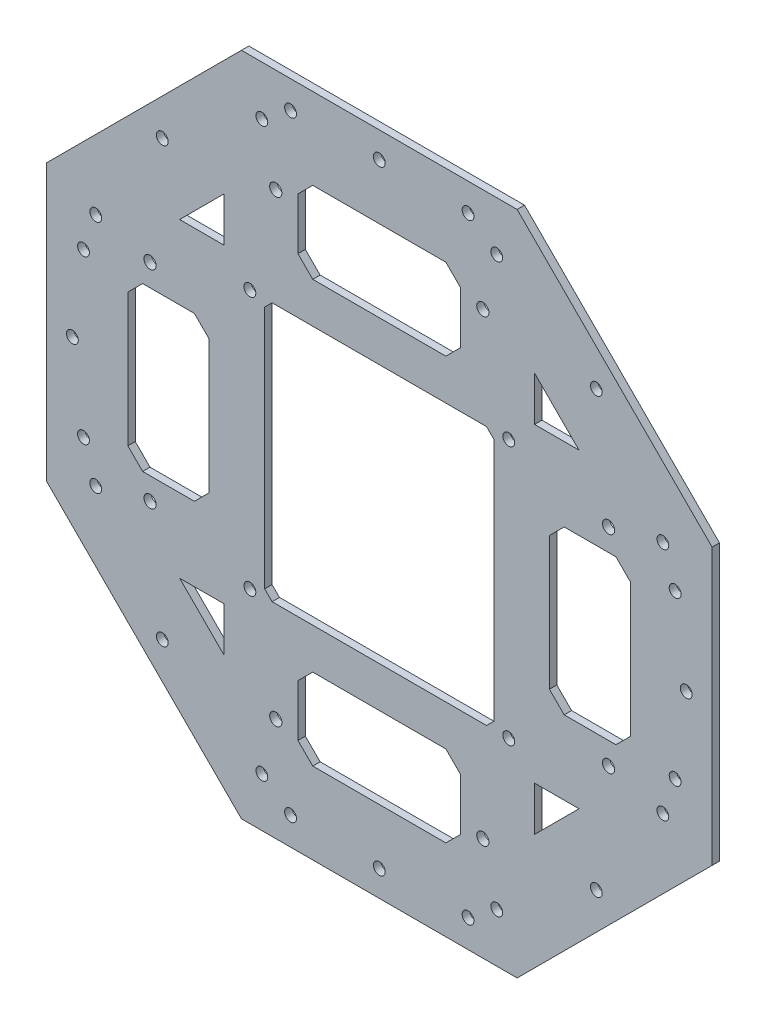
from build123d import *

# Parameters (mm, degrees)
SKETCH_1_R              = 1.6
EXTRUDE_16_DEPTH        = 2
SKETCH_2_R              = 1.6
CUT_EXTRUDE_M3_DEPTH    = 2
CUT_EXTRUDE_537_DEPTH   = 2
SKETCH_4_R              = 1.65
F_8XM3_DEPTH            = 2
CUT_EXTRUDE_62X70_DEPTH = 2


with BuildPart() as part:
    # 草图1 → 正八边形下板_外围16孔_无支脚孔 (new body)
    with BuildSketch(Plane.XY):
        Polygon((90, 37.279220614), (37.279220614, 90), (-37.279220614, 90), (-90, 37.279220614), (-90, -37.279220614), (-37.279220614, -90), (37.279220614, -90), (90, -37.279220614), align=None)
        with Locations((83, 0)):
            Circle(SKETCH_1_R, mode=Mode.SUBTRACT)
        with Locations((76.682001198, 31.762724886)):
            Circle(SKETCH_1_R, mode=Mode.SUBTRACT)
        with Locations((58.689862838, 58.689862838)):
            Circle(SKETCH_1_R, mode=Mode.SUBTRACT)
        with Locations((31.762724886, 76.682001198)):
            Circle(SKETCH_1_R, mode=Mode.SUBTRACT)
        with Locations((0, 83)):
            Circle(SKETCH_1_R, mode=Mode.SUBTRACT)
        with Locations((-31.762724886, 76.682001198)):
            Circle(SKETCH_1_R, mode=Mode.SUBTRACT)
        with Locations((-58.689862838, 58.689862838)):
            Circle(SKETCH_1_R, mode=Mode.SUBTRACT)
        with Locations((-76.682001198, 31.762724886)):
            Circle(SKETCH_1_R, mode=Mode.SUBTRACT)
        with Locations((-83, 0)):
            Circle(SKETCH_1_R, mode=Mode.SUBTRACT)
        with Locations((-76.682001198, -31.762724886)):
            Circle(SKETCH_1_R, mode=Mode.SUBTRACT)
        with Locations((-58.689862838, -58.689862838)):
            Circle(SKETCH_1_R, mode=Mode.SUBTRACT)
        with Locations((-31.762724886, -76.682001198)):
            Circle(SKETCH_1_R, mode=Mode.SUBTRACT)
        with Locations((0, -83)):
            Circle(SKETCH_1_R, mode=Mode.SUBTRACT)
        with Locations((31.762724886, -76.682001198)):
            Circle(SKETCH_1_R, mode=Mode.SUBTRACT)
        with Locations((58.689862838, -58.689862838)):
            Circle(SKETCH_1_R, mode=Mode.SUBTRACT)
        with Locations((76.682001198, -31.762724886)):
            Circle(SKETCH_1_R, mode=Mode.SUBTRACT)
        with Locations((-35, -35)):
            Circle(SKETCH_1_R, mode=Mode.SUBTRACT)
        with Locations((-35, 35)):
            Circle(SKETCH_1_R, mode=Mode.SUBTRACT)
        with Locations((35, -35)):
            Circle(SKETCH_1_R, mode=Mode.SUBTRACT)
        with Locations((35, 35)):
            Circle(SKETCH_1_R, mode=Mode.SUBTRACT)
        with Locations((-24, -82.5)):
            Circle(SKETCH_1_R, mode=Mode.SUBTRACT)
        with Locations((-24, 82.5)):
            Circle(SKETCH_1_R, mode=Mode.SUBTRACT)
        with Locations((24, -82.5)):
            Circle(SKETCH_1_R, mode=Mode.SUBTRACT)
        with Locations((24, 82.5)):
            Circle(SKETCH_1_R, mode=Mode.SUBTRACT)
    extrude(amount=EXTRUDE_16_DEPTH)

    # 草图2 → 左右摄像头铰链M3孔 (cut)
    with BuildSketch(Plane.XY):
        with Locations((-80, -22)):
            Circle(SKETCH_2_R)
        with Locations((-80, 22)):
            Circle(SKETCH_2_R)
        with Locations((80, -22)):
            Circle(SKETCH_2_R)
        with Locations((80, 22)):
            Circle(SKETCH_2_R)
    extrude(amount=CUT_EXTRUDE_M3_DEPTH, mode=Mode.SUBTRACT)

    # 草图3 → Cut-Extrude 537 (cut)
    with BuildSketch(Plane.XY):
        Polygon((24, 9.941125497), (9.941125497, 24), (-9.941125497, 24), (-24, 9.941125497), (-24, -9.941125497), (-9.941125497, -24), (9.941125497, -24), (24, -9.941125497), align=None)
        Polygon((-18, 46), (18, 46), (22, 50), (22, 64), (18, 68), (-18, 68), (-22, 64), (-22, 50), align=None)
        Polygon((-46, -18), (-46, 18), (-50, 22), (-64, 22), (-68, 18), (-68, -18), (-64, -22), (-50, -22), align=None)
        Polygon((18, -46), (-18, -46), (-22, -50), (-22, -64), (-18, -68), (18, -68), (22, -64), (22, -50), align=None)
        Polygon((46, 18), (46, -18), (50, -22), (64, -22), (68, -18), (68, 18), (64, 22), (50, 22), align=None)
        Polygon((-42, -42), (-54, -42), (-42, -54), align=None)
        Polygon((-42, 42), (-54, 42), (-42, 54), align=None)
        Polygon((42, -42), (54, -42), (42, -54), align=None)
        Polygon((42, 42), (54, 42), (42, 54), align=None)
    extrude(amount=CUT_EXTRUDE_537_DEPTH, mode=Mode.SUBTRACT)

    # 草图4 → 四向侧支脚上角座8xM3 (cut)
    with BuildSketch(Plane.XY):
        with Locations((-28, -62)):
            Circle(SKETCH_4_R)
        with Locations((-62, -28)):
            Circle(SKETCH_4_R)
        with Locations((28, -62)):
            Circle(SKETCH_4_R)
        with Locations((-62, 28)):
            Circle(SKETCH_4_R)
        with Locations((-28, 62)):
            Circle(SKETCH_4_R)
        with Locations((62, -28)):
            Circle(SKETCH_4_R)
        with Locations((28, 62)):
            Circle(SKETCH_4_R)
        with Locations((62, 28)):
            Circle(SKETCH_4_R)
    extrude(amount=F_8XM3_DEPTH, mode=Mode.SUBTRACT)

    # 草图6 → 飞控螺丝检修口_62x70 (cut)
    with BuildSketch(Plane.XY):
        Polygon((-29, -35), (29, -35), (31, -33), (31, 33), (29, 35), (-29, 35), (-31, 33), (-31, -33), align=None)
    extrude(amount=CUT_EXTRUDE_62X70_DEPTH, mode=Mode.SUBTRACT)


solid = part.part
